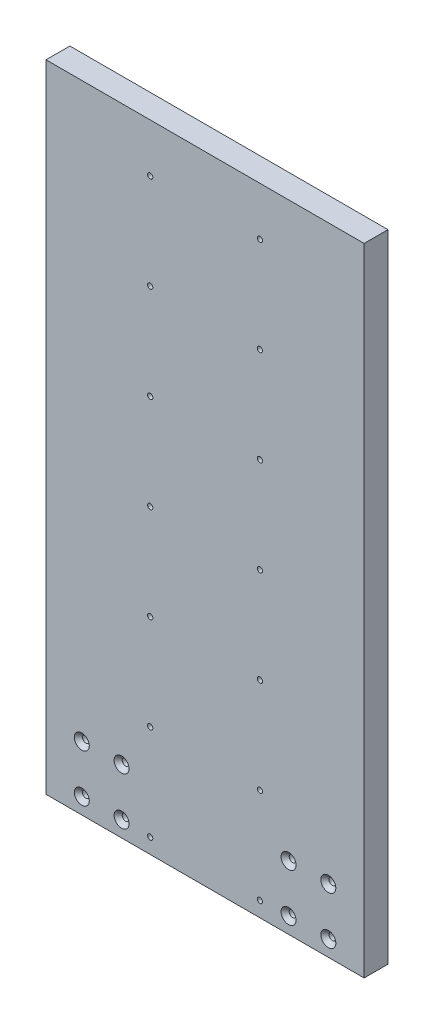
from build123d import *

# Parameters (mm, degrees)
SKETCH1_W                                       = 200
SKETCH1_H                                       = 400
BOSS_EXTRUDE1_DEPTH                             = 15
CSK_FOR_M4_FLAT_HEAD_MACHINE_SCREW1_D           = 4.3
CSK_FOR_M4_FLAT_HEAD_MACHINE_SCREW1_CSINK_D     = 9.4
CSK_FOR_M4_FLAT_HEAD_MACHINE_SCREW1_CSINK_ANGLE = 90
M4X0_7_TAPPED_HOLE1_D                           = 3.3


with BuildPart() as part:
    # Sketch1 → Boss-Extrude1 (new body)
    with BuildSketch(Plane.XY):
        Rectangle(SKETCH1_W, SKETCH1_H)
    extrude(amount=BOSS_EXTRUDE1_DEPTH)

    # CSK for M4 Flat Head Machine Screw1 (through all)
    with Locations(Plane.XY.offset(15)):
        with Locations((-77.5, -160), (-52.5, -160), (-52.5, -190), (-77.5, -190), (52.5, -160), (77.5, -160), (77.5, -190), (52.5, -190)):
            CounterSinkHole(CSK_FOR_M4_FLAT_HEAD_MACHINE_SCREW1_D / 2, CSK_FOR_M4_FLAT_HEAD_MACHINE_SCREW1_CSINK_D / 2, counter_sink_angle=CSK_FOR_M4_FLAT_HEAD_MACHINE_SCREW1_CSINK_ANGLE)

    # M4x0.7 Tapped Hole1 (through all)
    with Locations(Plane.XY.offset(15)):
        with Locations((-34.5, -190.5), (34.5, -190.5), (-34.5, -130.5), (34.5, -130.5), (-34.5, -70.5), (34.5, -70.5), (-34.5, -10.5), (34.5, -10.5), (-34.5, 49.5), (34.5, 49.5), (-34.5, 109.5), (34.5, 109.5), (-34.5, 169.5), (34.5, 169.5)):
            Hole(M4X0_7_TAPPED_HOLE1_D / 2)


solid = part.part
